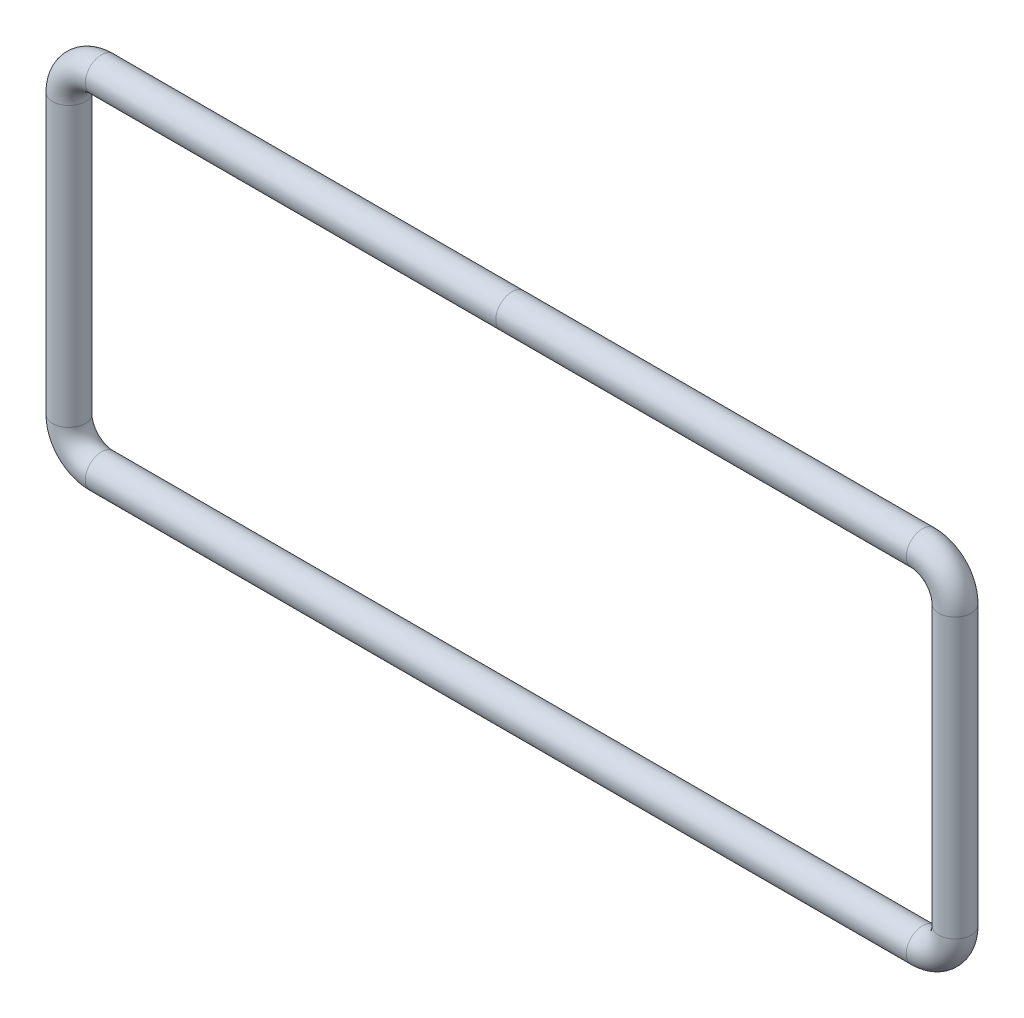
from build123d import *

# Parameters (mm, degrees)
ESBO_O2_R = 2.1


with BuildPart() as part:
    # Varredura1: sweep along a path in Esboço1
    with BuildLine(Plane.XY) as varredura1_path:
        Line((53, 22.2), (-53, 22.2))
        ThreePointArc((-53, 22.2), (-55.969848481, 20.969848481), (-57.2, 18))
        Line((-57.2, 18), (-57.2, -18))
        ThreePointArc((-57.2, -18), (-55.969848481, -20.969848481), (-53, -22.2))
        Line((-53, -22.2), (53, -22.2))
        ThreePointArc((53, -22.2), (55.969848481, -20.969848481), (57.2, -18))
        Line((57.2, -18), (57.2, 18))
        ThreePointArc((57.2, 18), (55.969848481, 20.969848481), (53, 22.2))
    # Esboço2 → Varredura1 (sweep)
    with BuildSketch(Plane(origin=(0, 0, 0), x_dir=(0, 0, -1), z_dir=(1, 0, 0))):
        with Locations((0, 22.2)):
            Circle(ESBO_O2_R)
    sweep(path=varredura1_path.line)


solid = part.part
